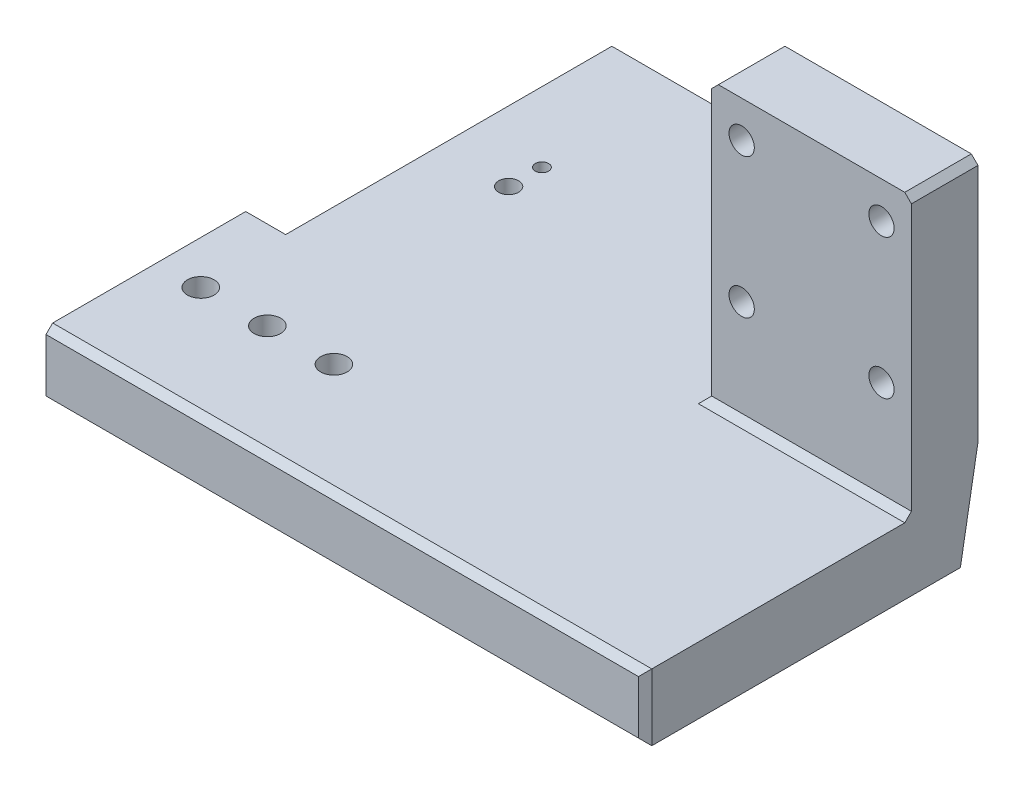
from build123d import *

# Parameters (mm, degrees)
SKETCH1_W           = 30
SKETCH1_H           = 52
SKETCH1_R           = 1.9
BOSS_EXTRUDE1_DEPTH = 10
CHAMFER1_SIZE       = 15
CHAMFER1_SIZE2      = 2.644904711
SKETCH2_W           = 5
SKETCH2_H           = 7.355095289
SKETCH2_H_2         = 30
BOSS_EXTRUDE2_DEPTH = 10
SKETCH3_R           = 1
SKETCH3_R_2         = 1.5
SKETCH3_R_3         = 2
CUT_EXTRUDE1_DEPTH  = 35
CHAMFER2_SIZE       = 1


with BuildPart() as part:
    # Sketch1 → Boss-Extrude1 (new body)
    with BuildSketch(Plane.XY):
        with Locations((15, 6)):
            Rectangle(SKETCH1_W, SKETCH1_H)
        with Locations((4.5, 26.5)):
            Circle(SKETCH1_R, mode=Mode.SUBTRACT)
        with Locations((25.5, 26.5)):
            Circle(SKETCH1_R, mode=Mode.SUBTRACT)
        with Locations((25.5, 5.5)):
            Circle(SKETCH1_R, mode=Mode.SUBTRACT)
        with Locations((4.5, 5.5)):
            Circle(SKETCH1_R, mode=Mode.SUBTRACT)
    extrude(amount=BOSS_EXTRUDE1_DEPTH)

    # Chamfer1
    chamfer1_edges = [part.edges().sort_by_distance(p)[0] for p in [
        (15, -20, 0),
    ]]
    chamfer1_side = [part.faces().sort_by_distance(p)[0] for p in [
        (15, 5.700491631, 0),
    ]]
    chamfer(chamfer1_edges, length=CHAMFER1_SIZE, length2=CHAMFER1_SIZE2, reference=chamfer1_side[0])

    # Sketch2 → Boss-Extrude2 (add)
    with BuildSketch(Plane.XZ.offset(20)):
        Polygon((0, 10), (30, 10), (30, 50), (-55, 50), (-55, 20), (-55, 10), (-5, 10), align=None)
        Polygon((-5, 2.644904711), (-5, 10), (-55, 10), (-55, -30), (-5, -30), align=None)
        with Locations((-2.5, 6.322452356)):
            Rectangle(SKETCH2_W, SKETCH2_H)
        with Locations((-57.5, 35)):
            Rectangle(SKETCH2_W, SKETCH2_H_2)
    extrude(amount=-BOSS_EXTRUDE2_DEPTH)

    # Sketch3 → Cut-Extrude1 (cut)
    with BuildSketch(Plane(origin=(0, -10, 0), x_dir=(1, 0, 0), z_dir=(0, 1, 0))):
        with Locations(Location((-43.5, 8, 0), (0, 0, 270))):
            Circle(SKETCH3_R)
        with Locations(Location((-43.5, 3, 0), (0, 0, 270))):
            Circle(SKETCH3_R_2)
        with Locations(Location((-33.5, -33.25, 0), (0, 0, 270))):
            Circle(SKETCH3_R_3)
        with Locations(Location((-53.5, -33.25, 0), (0, 0, 270))):
            Circle(SKETCH3_R_3)
        with Locations(Location((-43.5, -33.25, 0), (0, 0, 270))):
            Circle(SKETCH3_R_3)
    extrude(amount=-CUT_EXTRUDE1_DEPTH, mode=Mode.SUBTRACT)

    # Chamfer2
    chamfer2_edges = [part.edges().sort_by_distance(p)[0] for p in [
        (0, 32, 5),
        (30, 32, 5),
        (-15, -10, 50),
        (30, -15, 50),
        (-30, -10, -30),
        (-5, -15, -30),
        (-55, -15, -30),
        (-55, -20, -5),
        (-15, -20, 50),
        (-30, -20, -30),
        (-55, -10, -5),
        (15, -10, 10),
        (0, -10, 6.322452355),
    ]]
    chamfer(chamfer2_edges, length=CHAMFER2_SIZE)


solid = part.part
